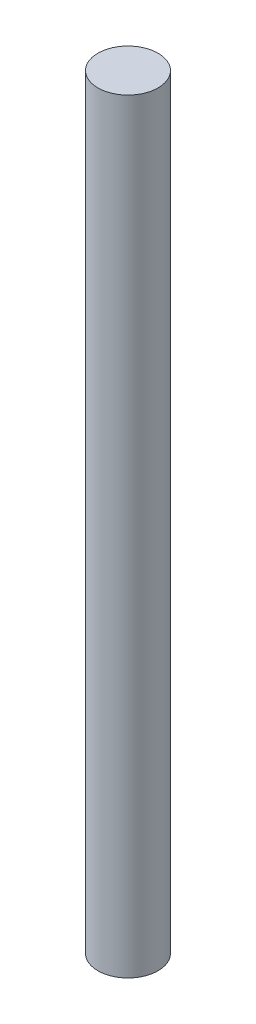
from build123d import *

# Parameters (mm, degrees)
SKETCH1_R           = 3.995
BOSS_EXTRUDE1_DEPTH = 101.6


with BuildPart() as part:
    # Sketch1 → Boss-Extrude1 (new body)
    with BuildSketch(Plane(origin=(0, 0, 0), x_dir=(1, 0, 0), z_dir=(0, 1, 0))):
        with Locations(Location((0, 0, 0), (0, 0, 270))):
            Circle(SKETCH1_R)
    extrude(amount=BOSS_EXTRUDE1_DEPTH)


solid = part.part
